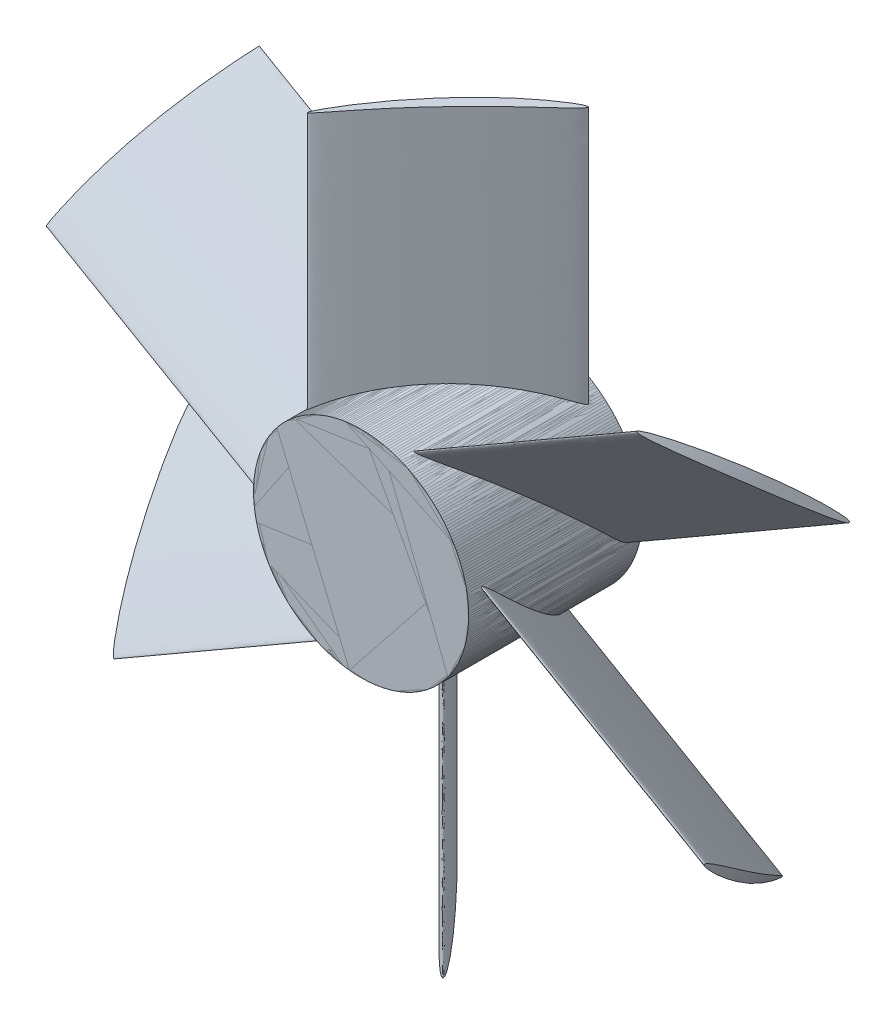
from build123d import *

# Parameters (mm, degrees)
CROQUIS1_R                               = 13
SALIENTE_EXTRUIR1_DEPTH                  = 21
CROQUIS12_RX                             = 12
CROQUIS12_RY                             = 0.66
SALIENTE_EXTRUIR4_DEPTH                  = 29
SALIENTE_EXTRUIR4_DIRECTION_2_REACH      = 37.861
SALIENTE_EXTRUIR4_DIRECTION_2_END_RADIUS = 13
MATRIZC5_COUNT                           = 6
CROQUIS13_OUTSIDE_W                      = 106.65
CROQUIS13_OUTSIDE_H                      = 109.706
CROQUIS13_OUTSIDE_R                      = 42
CORTAR_EXTRUIR1_DEPTH                    = 50


with BuildPart() as part:
    # Croquis1 → Saliente-Extruir1 (new body)
    with BuildSketch(Plane.XY):
        with Locations(Location((0, 0, 0), (0, 0, 180))):
            Circle(CROQUIS1_R)
    extrude(amount=SALIENTE_EXTRUIR1_DEPTH)

    # Croquis12 → Saliente-Extruir4 (add)
    with BuildSketch(Plane(origin=(0, 13, 0), x_dir=(1, 0, 0), z_dir=(0, 1, 0))):
        with Locations(Location((0, -10.5), (0, 0, 47))):
            Ellipse(CROQUIS12_RX, CROQUIS12_RY)
    extrude(amount=SALIENTE_EXTRUIR4_DEPTH)

    # Saliente-Extruir4 direction 2: up to this cylinder (the profile starts outside it)
    saliente_extruir4_direction_2_end = Plane(origin=(0, 0, 10.5), z_dir=(0, 0, -1)) * Cylinder(SALIENTE_EXTRUIR4_DIRECTION_2_END_RADIUS, 102.722, mode=Mode.PRIVATE)
    # Croquis12 → Saliente-Extruir4 direction 2 (add, up to the surface)
    with BuildSketch(Plane(origin=(0, 13, 0), x_dir=(1, 0, 0), z_dir=(0, 1, 0)), mode=Mode.PRIVATE) as saliente_extruir4_direction_2_sk1:
        with Locations(Location((0, -10.5), (0, 0, 47))):
            Ellipse(CROQUIS12_RX, CROQUIS12_RY)
    saliente_extruir4_direction_2_tool1 = extrude(saliente_extruir4_direction_2_sk1.sketch, amount=-SALIENTE_EXTRUIR4_DIRECTION_2_REACH, mode=Mode.PRIVATE) - saliente_extruir4_direction_2_end
    add(saliente_extruir4_direction_2_tool1.solids().sort_by_distance((0, 13, 10.5))[0])
    add(saliente_extruir4_direction_2_tool1.solids().sort_by_distance((0, 13, 10.5))[1])


with BuildPart() as matrizc5_1:
    # MatrizC5: pattern copy
    add(part.part.rotate(Axis((0, 0, -1.05), (0, 0, 1)), 1 * 360 / MATRIZC5_COUNT))


with BuildPart() as matrizc5_2:
    # MatrizC5: pattern copy
    add(part.part.rotate(Axis((0, 0, -1.05), (0, 0, 1)), 2 * 360 / MATRIZC5_COUNT))


with BuildPart() as matrizc5_3:
    # MatrizC5: pattern copy
    add(part.part.rotate(Axis((0, 0, -1.05), (0, 0, 1)), 3 * 360 / MATRIZC5_COUNT))


with BuildPart() as matrizc5_4:
    # MatrizC5: pattern copy
    add(part.part.rotate(Axis((0, 0, -1.05), (0, 0, 1)), 4 * 360 / MATRIZC5_COUNT))


with BuildPart() as matrizc5_5:
    # MatrizC5: pattern copy
    add(part.part.rotate(Axis((0, 0, -1.05), (0, 0, 1)), 5 * 360 / MATRIZC5_COUNT))


with BuildPart() as cortar_extruir1_tool:
    # Croquis13 outside → Cortar-Extruir1 (new body)
    with BuildSketch(Plane.XY):
        Rectangle(CROQUIS13_OUTSIDE_W, CROQUIS13_OUTSIDE_H)
        Circle(CROQUIS13_OUTSIDE_R, mode=Mode.SUBTRACT)
    extrude(amount=CORTAR_EXTRUIR1_DEPTH)


with BuildPart() as part_1:
    add(part.part)

    # Cortar-Extruir1: cut by cortar_extruir1_tool
    add(cortar_extruir1_tool.part, mode=Mode.SUBTRACT)


with BuildPart() as matrizc5_1_1:
    add(matrizc5_1.part)

    # Cortar-Extruir1: cut by cortar_extruir1_tool
    add(cortar_extruir1_tool.part, mode=Mode.SUBTRACT)


with BuildPart() as matrizc5_2_1:
    add(matrizc5_2.part)

    # Cortar-Extruir1: cut by cortar_extruir1_tool
    add(cortar_extruir1_tool.part, mode=Mode.SUBTRACT)


with BuildPart() as matrizc5_3_1:
    add(matrizc5_3.part)

    # Cortar-Extruir1: cut by cortar_extruir1_tool
    add(cortar_extruir1_tool.part, mode=Mode.SUBTRACT)


with BuildPart() as matrizc5_4_1:
    add(matrizc5_4.part)

    # Cortar-Extruir1: cut by cortar_extruir1_tool
    add(cortar_extruir1_tool.part, mode=Mode.SUBTRACT)


with BuildPart() as matrizc5_5_1:
    add(matrizc5_5.part)

    # Cortar-Extruir1: cut by cortar_extruir1_tool
    add(cortar_extruir1_tool.part, mode=Mode.SUBTRACT)


solid = Compound([part_1.part, matrizc5_1_1.part, matrizc5_2_1.part, matrizc5_3_1.part, matrizc5_4_1.part, matrizc5_5_1.part])
